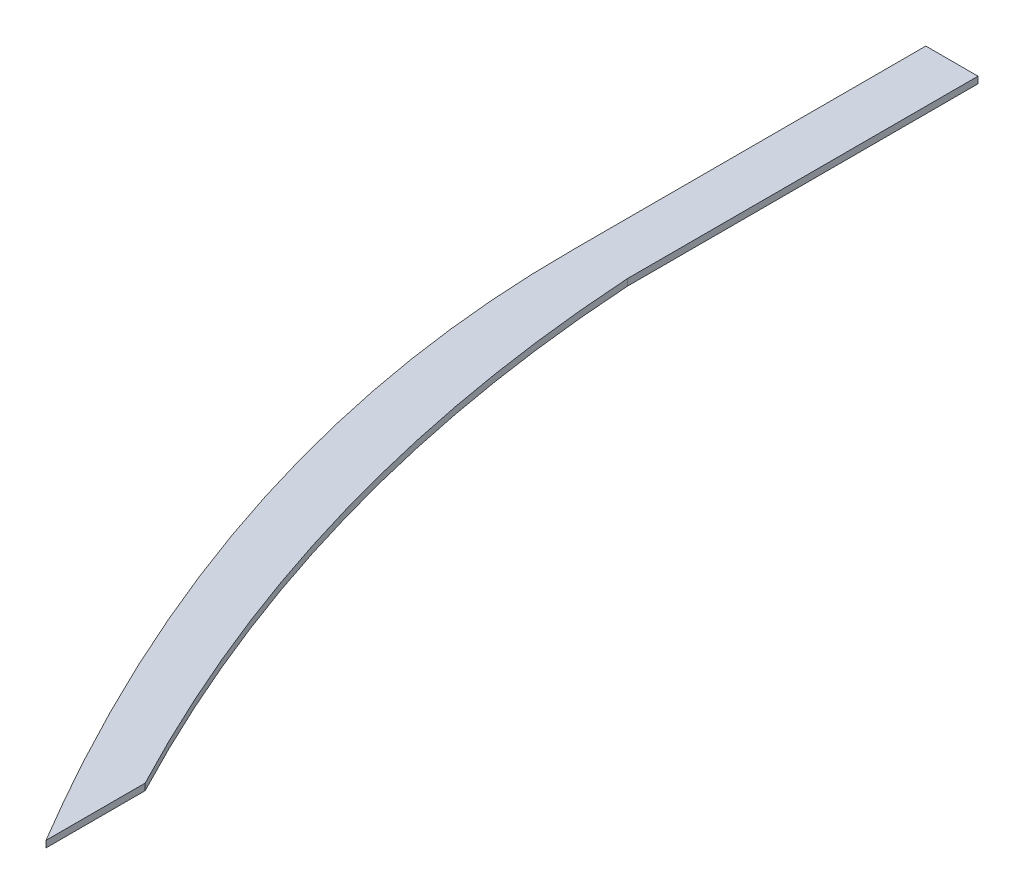
from build123d import *

# Parameters (mm, degrees)
BOSS_EXTRUDE1_DEPTH = 4


with BuildPart() as part:
    # Sketch1 → Boss-Extrude1 (new body)
    with BuildSketch(Plane(origin=(0, 0, 0), x_dir=(1, 0, 0), z_dir=(0, 1, 0))):
        with BuildLine():
            Line((-82.88203441, 336.412581574), (-82.88203441, 124.412581574))
            add(Edge.make_bspline(
                [(-82.88203441, 124.412581574), (-84.157680917, -91.990341969), (67.11796559, -345.800506642)],
                knots=[0, 0, 0, 1, 1, 1], degree=2))
            Line((67.11796559, -345.800506642), (67.11796559, -285.827231403))
            add(Edge.make_bspline(
                [(-51.312602552, 124.412581574), (-38.284160414, -84.718424906), (67.11796559, -285.827231403)],
                knots=[0, 0, 0, 1, 1, 1], degree=2))
            Line((-51.312602552, 124.412581574), (-51.312602552, 336.412581574))
            Line((-51.312602552, 336.412581574), (-82.88203441, 336.412581574))
        make_face()
    extrude(amount=BOSS_EXTRUDE1_DEPTH)


solid = part.part
